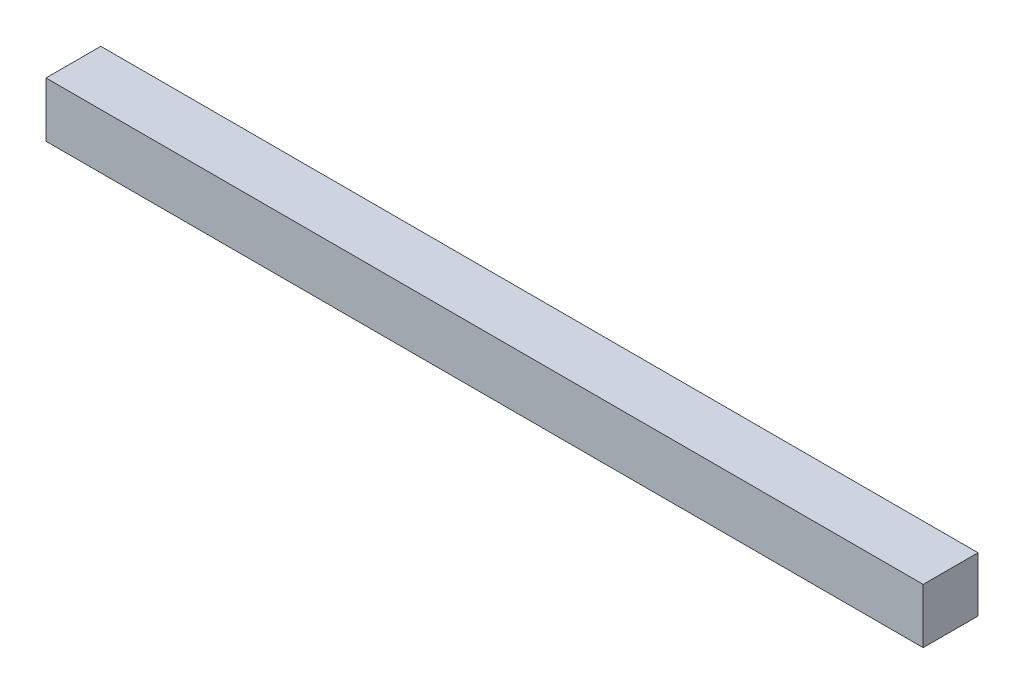
from build123d import *

# Parameters (mm, degrees)
SKETCH1_W           = 6.35
SKETCH1_H           = 6.35
BOSS_EXTRUDE1_DEPTH = 50.8


with BuildPart() as part:
    # Sketch1 → Boss-Extrude1 (new, symmetric)
    with BuildSketch(Plane(origin=(0, 0, 0), x_dir=(0, 0, -1), z_dir=(1, 0, 0))):
        Rectangle(SKETCH1_W, SKETCH1_H)
    extrude(amount=BOSS_EXTRUDE1_DEPTH, both=True)


solid = part.part
